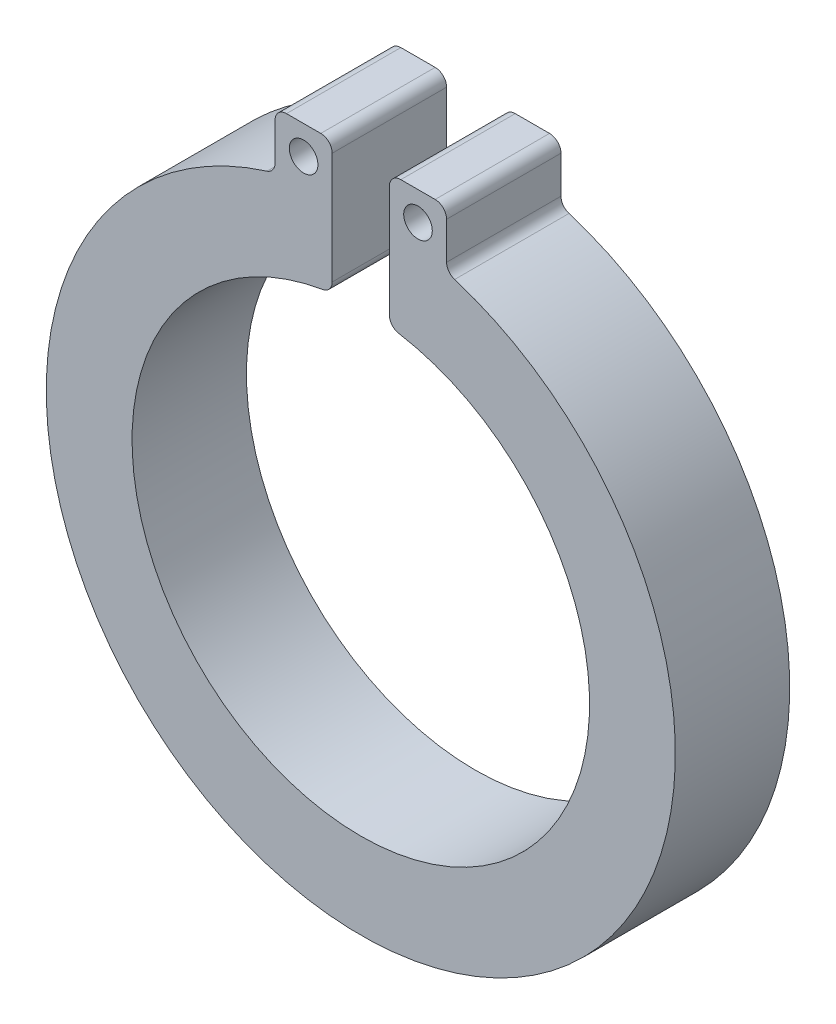
from build123d import *

# Parameters (mm, degrees)
SKETCH1_R           = 0.125
BOSS_EXTRUDE1_DEPTH = 1
FILLET1_R           = 0.1


with BuildPart() as part:
    # Sketch1 → Boss-Extrude1 (new body)
    with BuildSketch(Plane.XY):
        with BuildLine():
            Line((-0.25, 3.145751311), (-0.25, 1.984313483))
            ThreePointArc((-0.25, 1.984313483), (0, -2), (0.25, 1.984313483))
            Line((0.25, 1.984313483), (0.25, 3.145751311))
            Line((0.25, 3.145751311), (0.75, 3.145751311))
            Line((0.75, 3.145751311), (0.75, 2.645751311))
            ThreePointArc((0.75, 2.645751311), (0, -2.75), (-0.75, 2.645751311))
            Line((-0.75, 2.645751311), (-0.75, 3.145751311))
            Line((-0.75, 3.145751311), (-0.25, 3.145751311))
        make_face()
        with Locations((-0.5, 2.895751311)):
            Circle(SKETCH1_R, mode=Mode.SUBTRACT)
        with Locations((0.5, 2.895751311)):
            Circle(SKETCH1_R, mode=Mode.SUBTRACT)
    extrude(amount=BOSS_EXTRUDE1_DEPTH)

    # Fillet1
    fillet1_edges = [part.edges().sort_by_distance(p)[0] for p in [
        (-0.25, 3.145751311, 0.5),
        (-0.25, 1.984313483, 0.5),
        (0.25, 1.984313483, 0.5),
        (0.25, 3.145751311, 0.5),
        (0.75, 3.145751311, 0.5),
        (0.75, 2.645751311, 0.5),
        (-0.75, 2.645751311, 0.5),
        (-0.75, 3.145751311, 0.5),
    ]]
    fillet(fillet1_edges, radius=FILLET1_R)


solid = part.part
